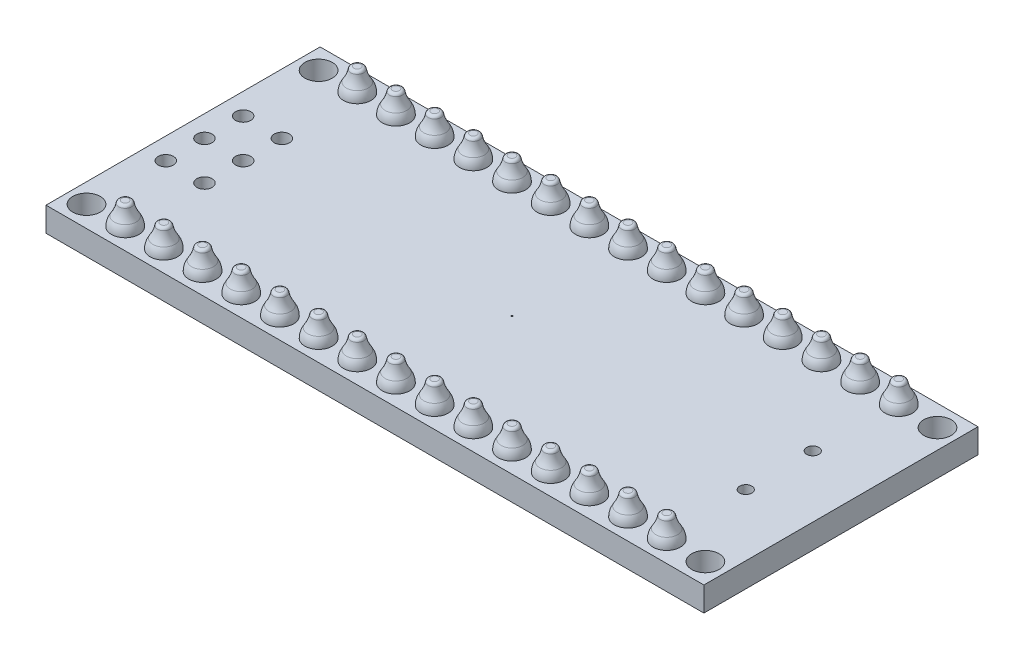
from build123d import *

# Parameters (mm, degrees)
SKETCH1_W            = 43.2
SKETCH1_H            = 18
SKETCH1_R            = 0.05
BOSS_EXTRUDE2_DEPTH  = 1.6
SKETCH2_R            = 0.45
CUT_EXTRUDE2_DEPTH   = 1.6
LPATTERN1_COUNT      = 15
LPATTERN1_PITCH      = 2.54
SKETCH3_R            = 0.5
CUT_EXTRUDE4_DEPTH   = 1.6
SKETCH4_R            = 0.9
CUT_EXTRUDE5_DEPTH   = 1.6
LPATTERN2_COUNT      = 2
LPATTERN2_PITCH      = 15.24
LPATTERN2_COUNT_DIR2 = 15
LPATTERN2_PITCH_DIR2 = 2.54
LPATTERN3_COUNT      = 2
LPATTERN3_PITCH      = 2.54
LPATTERN3_COUNT_DIR2 = 3
LPATTERN3_PITCH_DIR2 = 2.54
SKETCH9_R            = 0.4
CUT_EXTRUDE6_DEPTH   = 10


with BuildPart() as part:
    # Sketch1 → Boss-Extrude2 (new body)
    with BuildSketch(Plane(origin=(0, 0, 0), x_dir=(1, 0, 0), z_dir=(0, 1, 0))):
        with Locations((17.78, 7.62)):
            Rectangle(SKETCH1_W, SKETCH1_H)
        with Locations(Location((17.78, 7.62, 0), (0, 0, 270))):
            Circle(SKETCH1_R, mode=Mode.SUBTRACT)
    extrude(amount=BOSS_EXTRUDE2_DEPTH)

    # Sketch2 → Cut-Extrude2 (cut)
    with BuildSketch(Plane(origin=(0, 0, 0), x_dir=(1, 0, 0), z_dir=(0, 1, 0))):
        with Locations(Location((0, 0, 0), (0, 0, 270))):
            Circle(SKETCH2_R)
        with Locations(Location((0, 15.24, 0), (0, 0, 270))):
            Circle(SKETCH2_R)
    cut_extrude2 = extrude(amount=CUT_EXTRUDE2_DEPTH, mode=Mode.SUBTRACT)

    # LPattern1: Cut-Extrude2 ×15
    with Locations(*[(i * LPATTERN1_PITCH, 0, 0) for i in range(1, LPATTERN1_COUNT)]):
        add(cut_extrude2, mode=Mode.SUBTRACT)

    # Sketch3 → Cut-Extrude4 (cut)
    with BuildSketch(Plane(origin=(0, 0, 0), x_dir=(1, 0, 0), z_dir=(0, 1, 0))):
        with Locations(Location((0.127, 10.16, 0), (0, 0, 270))):
            Circle(SKETCH3_R)
        with Locations(Location((-2.413, 10.16, 0), (0, 0, 270))):
            Circle(SKETCH3_R)
        with Locations(Location((-2.413, 7.62, 0), (0, 0, 270))):
            Circle(SKETCH3_R)
        with Locations(Location((-2.413, 5.08, 0), (0, 0, 270))):
            Circle(SKETCH3_R)
        with Locations(Location((0.127, 5.08, 0), (0, 0, 270))):
            Circle(SKETCH3_R)
        with Locations(Location((0.127, 7.62, 0), (0, 0, 270))):
            Circle(SKETCH3_R)
    extrude(amount=CUT_EXTRUDE4_DEPTH, mode=Mode.SUBTRACT)

    # Sketch4 → Cut-Extrude5 (cut)
    with BuildSketch(Plane(origin=(0, 0, 0), x_dir=(1, 0, 0), z_dir=(0, 1, 0))):
        with Locations(Location((38.1, 15.24, 0), (0, 0, 270))):
            Circle(SKETCH4_R)
        with Locations(Location((38.1, 0, 0), (0, 0, 270))):
            Circle(SKETCH4_R)
        with Locations(Location((-2.54, 0, 0), (0, 0, 270))):
            Circle(SKETCH4_R)
        with Locations(Location((-2.54, 15.24, 0), (0, 0, 270))):
            Circle(SKETCH4_R)
    extrude(amount=CUT_EXTRUDE5_DEPTH, mode=Mode.SUBTRACT)

    # Sketch6 → Revolve1 (revolve)
    with BuildSketch(Plane(origin=(0, 0, 0), x_dir=(0, 0, -1), z_dir=(1, 0, 0))):
        with BuildLine():
            Line((0, 1.6), (0.9, 1.6))
            ThreePointArc((0.9, 1.6), (0.852442497, 1.91994498), (0.713882199, 2.212224898))
            ThreePointArc((0.713882199, 2.212224898), (0.530499248, 2.558589224), (0.422081551, 2.93520993))
            ThreePointArc((0.422081551, 2.93520993), (0.353575878, 3.053365554), (0.225205293, 3.1))
            Line((0.225205293, 3.1), (0, 3.1))
            Line((0, 3.1), (0, 1.6))
        make_face()
    revolve1 = revolve(axis=Axis((0, 1.372239532, 0), (0, 1, 0)))

    # LPattern2: Revolve1 2 × 15
    with Locations(*[(j * LPATTERN2_PITCH_DIR2, 0, -i * LPATTERN2_PITCH) for i in range(LPATTERN2_COUNT) for j in range(LPATTERN2_COUNT_DIR2) if (i, j) != (0, 0)]):
        add(revolve1)

    # Sketch7 → Revolve2 (revolve)
    with BuildSketch(Plane.XY.offset(-5.08), mode=Mode.PRIVATE) as revolve2_sk:
        with BuildLine():
            Line((0.127, 0), (1.027, 0))
            ThreePointArc((1.027, 0), (0.970551628, -0.347850543), (0.807, -0.66))
            ThreePointArc((0.807, -0.66), (0.629174555, -0.974977034), (0.537980562, -1.325))
            ThreePointArc((0.537980562, -1.325), (0.471836779, -1.45), (0.339549213, -1.5))
            Line((0.339549213, -1.5), (0.127, -1.5))
            Line((0.127, -1.5), (0.127, 0))
        make_face()
    revolve2 = revolve(revolve2_sk.sketch.rotate(Axis((0.127, 3.888986093, -5.08), (0, -1, 0)), 90), axis=Axis((0.127, 3.888986093, -5.08), (0, -1, 0)))

    # LPattern3: Revolve2 2 × 3
    with Locations(*[(-i * LPATTERN3_PITCH, 0, -j * LPATTERN3_PITCH_DIR2) for i in range(LPATTERN3_COUNT) for j in range(LPATTERN3_COUNT_DIR2) if (i, j) != (0, 0)]):
        add(revolve2)

    # Sketch9 → Cut-Extrude6 (cut)
    with BuildSketch(Plane(origin=(0, 0, 0), x_dir=(1, 0, 0), z_dir=(0, 1, 0))):
        with Locations(Location((35.33, 5.42, 0), (0, 0, 270))):
            Circle(SKETCH9_R)
        with Locations(Location((35.33, 9.82, 0), (0, 0, 270))):
            Circle(SKETCH9_R)
    extrude(amount=CUT_EXTRUDE6_DEPTH, mode=Mode.SUBTRACT)


solid = part.part
